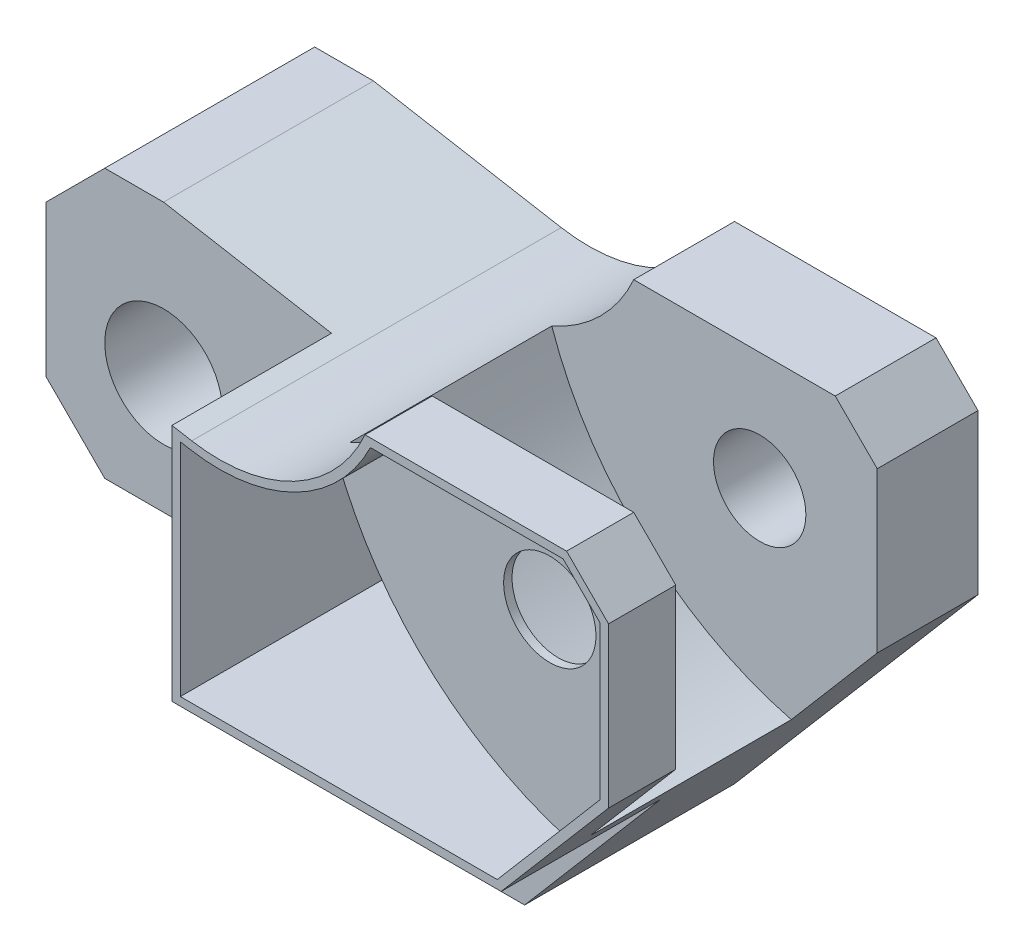
from build123d import *

# Parameters (mm, degrees)
SKETCH1_R               = 7
BOSS_EXTRUDE1_DEPTH     = 22
SKETCH2_R               = 7
CUT_EXTRUDE1_DEPTH      = 19
SKETCH2_3_R             = 5.5
CUT_EXTRUDE2_DEPTH      = 99.478424033
CUT_EXTRUDE3_DEPTH      = 14
CUT_EXTRUDE3_DEPTH_BACK = 10
CUT_EXTRUDE4_DEPTH      = 7
CUT_EXTRUDE5_DEPTH      = 25


with BuildPart() as part:
    # Sketch1 → Boss-Extrude1 (new, symmetric)
    with BuildSketch(Plane.XY):
        with BuildLine():
            Line((0, 0), (-7, 7))
            Line((-7, 7), (-7, 25))
            Line((-7, 25), (0, 32))
            Line((0, 32), (7, 32))
            Line((7, 32), (29.361380836, 28.057085233))
            ThreePointArc((29.361380836, 28.057085233), (41.561098706, 29.982044142), (50, 39))
            Line((50, 39), (74, 39))
            Line((74, 39), (79, 34))
            Line((79, 34), (79, 15))
            Line((79, 15), (50, -19))
            Line((50, -19), (44.296980053, -19))
            ThreePointArc((44.296980053, -19), (39.858007856, -12.115672061), (37.521177653, -4.264705882))
            ThreePointArc((37.521177653, -4.264705882), (35.840774692, -1.213413768), (32.575538911, 0))
            Line((32.575538911, 0), (0, 0))
        make_face()
        with Locations((7, 14)):
            Circle(SKETCH1_R, mode=Mode.SUBTRACT)
    extrude(amount=BOSS_EXTRUDE1_DEPTH, both=True)

    # Sketch2 → Cut-Extrude1 (cut)
    # profile 1 of 2: a face of its own
    with BuildSketch(Plane.XY.offset(22)):
        Polygon((24.613803159, 0), (27, 0), (27, 28.473460386), (7, 32), (0, 32), (-7, 25), (-7, 7), (0, 0), align=None)
        with Locations((7, 14)):
            Circle(SKETCH2_R, mode=Mode.SUBTRACT)
    # profile 2 of 2: a face of its own
    with BuildSketch(Plane.XY.offset(22)):
        with BuildLine():
            Line((66.205882353, 0), (32.575538911, 0))
            ThreePointArc((32.575538911, 0), (35.840774692, -1.213413768), (37.521177653, -4.264705882))
            ThreePointArc((37.521177653, -4.264705882), (39.858007856, -12.115672061), (44.296980053, -19))
            Line((44.296980053, -19), (50, -19))
            Line((50, -19), (66.205882353, 0))
        make_face()
    extrude(amount=-CUT_EXTRUDE1_DEPTH, mode=Mode.SUBTRACT)

    # Sketch2<3> → Cut-Extrude2 (cut, through all)
    with BuildSketch(Plane.XY.offset(22)):
        with Locations((65, 25)):
            Circle(SKETCH2_3_R)
    extrude(amount=-CUT_EXTRUDE2_DEPTH, mode=Mode.SUBTRACT)

    # Sketch3 → Cut-Extrude3 (cut, two sides: drawn at the far end of the back side and taken through both)
    with BuildSketch(Plane.XY.offset(-CUT_EXTRUDE3_DEPTH_BACK)):
        with BuildLine():
            Line((68.764705882, 3), (79, 15))
            Line((79, 15), (79, 34))
            Line((79, 34), (74, 39))
            Line((74, 39), (50, 39))
            ThreePointArc((50, 39), (46.021244343, 33.259333621), (40.236936549, 29.344294617))
            ThreePointArc((40.236936549, 29.344294617), (51.184262982, 12.580705229), (68.764705882, 3))
        make_face()
    extrude(amount=CUT_EXTRUDE3_DEPTH + CUT_EXTRUDE3_DEPTH_BACK, mode=Mode.SUBTRACT)

    # Sketch4 → Cut-Extrude4 (cut)
    with BuildSketch(Plane.XY.offset(22)):
        with BuildLine():
            Line((29.187732658, 27.07227748), (28, 27.281706793))
            Line((28, 27.281706793), (28, 1))
            Line((28, 1), (65.744476296, 1))
            Line((65.744476296, 1), (78, 15.368545033))
            Line((78, 15.368545033), (78, 33.585786438))
            Line((78, 33.585786438), (73.585786438, 38))
            Line((73.585786438, 38), (50.636084685, 38))
            ThreePointArc((50.636084685, 38), (41.740005768, 28.948047079), (29.187732658, 27.07227748))
        make_face()
    extrude(amount=-CUT_EXTRUDE4_DEPTH, mode=Mode.SUBTRACT)

    # Sketch5 → Cut-Extrude5 (cut)
    with BuildSketch(Plane.XY.offset(15)):
        with BuildLine():
            Line((29.187732658, 27.07227748), (28, 27.281706793))
            Line((28, 27.281706793), (28, 1))
            Line((28, 1), (65.744476296, 1))
            Line((65.744476296, 1), (66.986847747, 2.456573425))
            ThreePointArc((66.986847747, 2.456573425), (50.310181683, 12.027872638), (39.646682943, 28.028208705))
            ThreePointArc((39.646682943, 28.028208705), (34.481076416, 26.851449437), (29.187732658, 27.07227748))
        make_face()
    extrude(amount=-CUT_EXTRUDE5_DEPTH, mode=Mode.SUBTRACT)


solid = part.part
